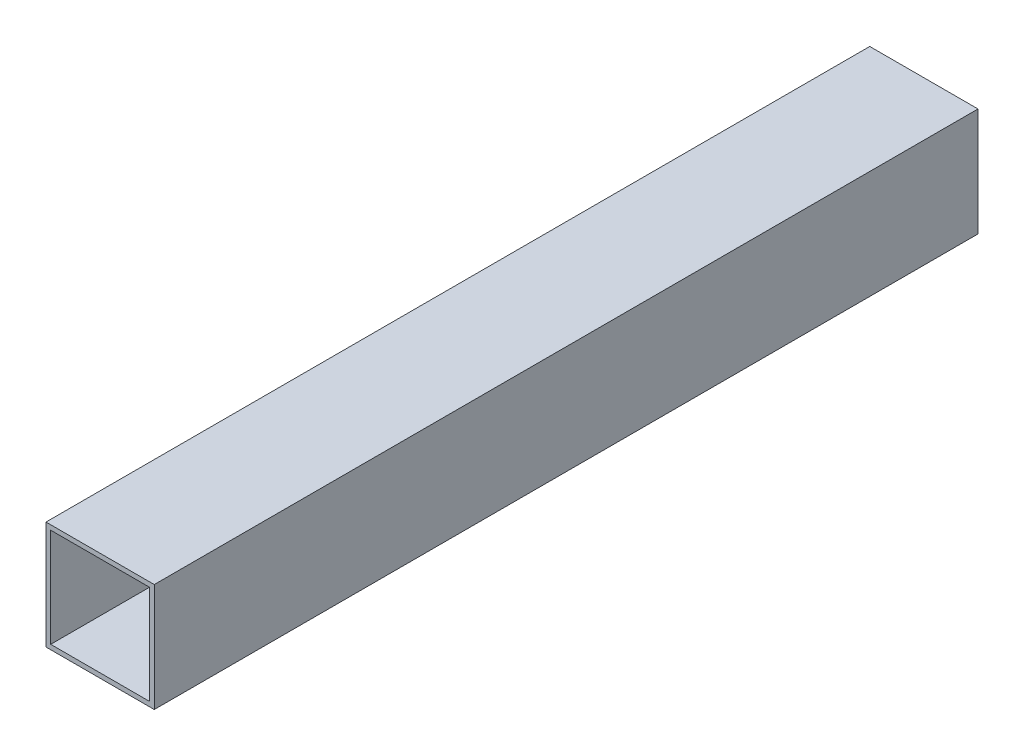
from build123d import *

# Parameters (mm, degrees)
ESBO_O1_W                = 46
ESBO_O1_H                = 46
ESBO_O1_W_2              = 42
ESBO_O1_H_2              = 42
RESSALTO_EXTRUS_O1_DEPTH = 350


with BuildPart() as part:
    # Esboço1 → Ressalto-extrusão1 (new body)
    with BuildSketch(Plane.XY):
        with Locations((23, 23)):
            Rectangle(ESBO_O1_W, ESBO_O1_H)
        with Locations((23, 23)):
            Rectangle(ESBO_O1_W_2, ESBO_O1_H_2, mode=Mode.SUBTRACT)
    extrude(amount=RESSALTO_EXTRUS_O1_DEPTH)


solid = part.part
